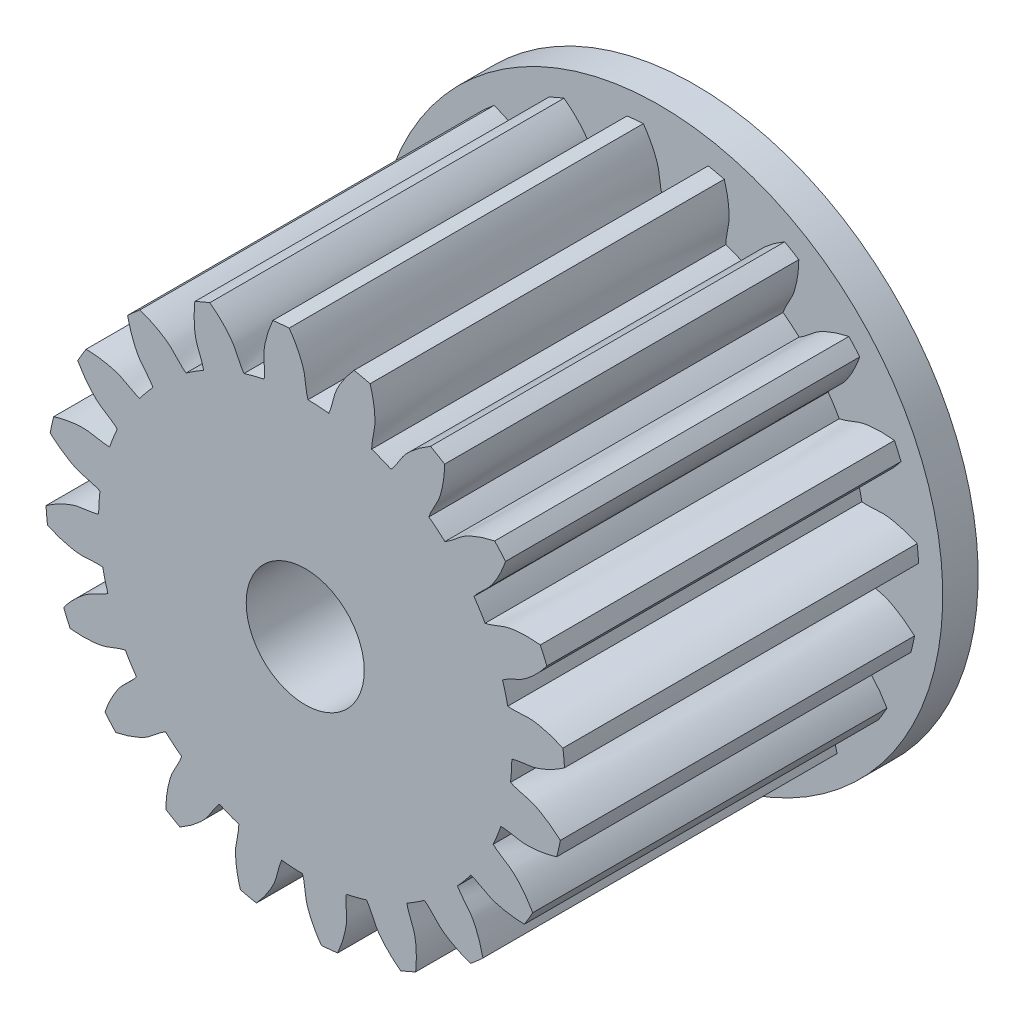
from build123d import *

# Parameters (mm, degrees)
SKETCH_1_R               = 8.75
SKETCH_1_R_2             = 2.5
EXTRUDE_1_DEPTH          = 15
EXTRUDE_2_DEPTH          = 15
PATTERN_CIRCULAR_1_COUNT = 20
SKETCH_4_R               = 12
SKETCH_4_R_2             = 7
EXTRUDE_4_DEPTH          = 1.5
CUT_EXTRUDE_START        = -0.5
SKETCH_6_R               = 7
CUT_EXTRUDE_1_DEPTH      = 0.5


with BuildPart() as part:
    # 草图1 → 凸台-拉伸1 (new body)
    with BuildSketch(Plane.XY):
        Circle(SKETCH_1_R)
        Circle(SKETCH_1_R_2, mode=Mode.SUBTRACT)
    extrude(amount=EXTRUDE_1_DEPTH)

    # 草图2 → 凸台-拉伸2 (add)
    with BuildSketch(Plane.XY):
        with BuildLine():
            ThreePointArc((10.914133667, 1.371745716), (10.952009933, 1.026390969), (10.978960935, 0.680012338))
            add(Edge.make_bspline(
                [(10.978960935, 0.680012338), (10.77961005, 0.541693977), (10.472216121, 0.353536805), (10.042144404, 0.161005618), (9.515919269, -0.026228629), (9.061327968, -0.01253637), (8.7492449, -0.114950781)],
                knots=[0, 0, 0, 0, 0.304014618, 0.449161344, 0.589717395, 1, 1, 1, 1], degree=3))
            ThreePointArc((8.7492449, -0.114950781), (8.711826083, 0.816447362), (8.575537338, 1.738579699))
            add(Edge.make_bspline(
                [(10.914133667, 1.371745716), (10.692554171, 1.470615689), (10.3555528, 1.598381981), (9.897197112, 1.707652299), (9.345346496, 1.793852377), (8.901214987, 1.695934393), (8.575537338, 1.738579699)],
                knots=[0, 0, 0, 0, 0.304014618, 0.449161344, 0.589717395, 1, 1, 1, 1], degree=3))
        make_face()
    extrude_2 = extrude(amount=EXTRUDE_2_DEPTH)

    # 阵列(圆周)1: 凸台-拉伸2 ×20 about axis
    pattern_circular_1_axis = Axis((0, 0, 15), (0, 0, -1))
    for i in range(1, PATTERN_CIRCULAR_1_COUNT):
        add(extrude_2.rotate(pattern_circular_1_axis, i * 360 / PATTERN_CIRCULAR_1_COUNT))

    # 草图4 → 凸台-拉伸4 (add)
    with BuildSketch(Plane(origin=(0, 0, 0), x_dir=(-1, 0, 0), z_dir=(0, 0, -1))):
        Circle(SKETCH_4_R)
        Circle(SKETCH_4_R_2, mode=Mode.SUBTRACT)
    extrude(amount=EXTRUDE_4_DEPTH)

    # 草图6 → 切除-拉伸1 (cut)
    with BuildSketch(Plane(origin=(0, 0, 0), x_dir=(-1, 0, 0), z_dir=(0, 0, -1)).offset(CUT_EXTRUDE_START)):
        Circle(SKETCH_6_R)
    extrude(amount=CUT_EXTRUDE_1_DEPTH, mode=Mode.SUBTRACT)


solid = part.part
